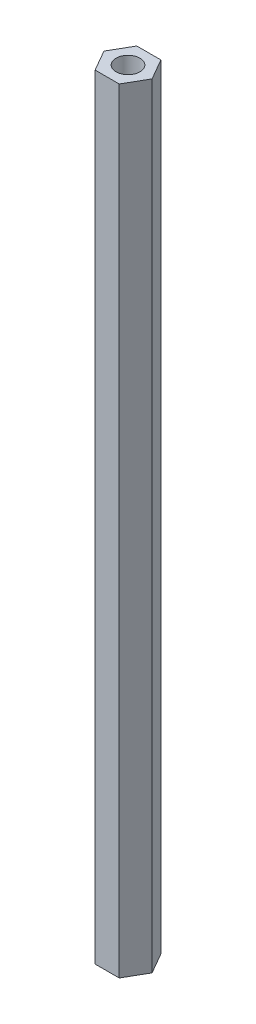
from build123d import *

# Parameters (mm, degrees)
SKETCH1_R           = 2
BOSS_EXTRUDE1_DEPTH = 130


with BuildPart() as part:
    # Sketch1 → Boss-Extrude1 (new body)
    with BuildSketch(Plane(origin=(0, 0, 0), x_dir=(1, 0, 0), z_dir=(0, 1, 0))):
        Polygon((4.041451884, 0), (2.020725942, 3.5), (-2.020725942, 3.5), (-4.041451884, 0), (-2.020725942, -3.5), (2.020725942, -3.5), align=None)
        with Locations(Location((0, 0, 0), (0, 0, 270))):
            Circle(SKETCH1_R, mode=Mode.SUBTRACT)
    extrude(amount=BOSS_EXTRUDE1_DEPTH)


solid = part.part
